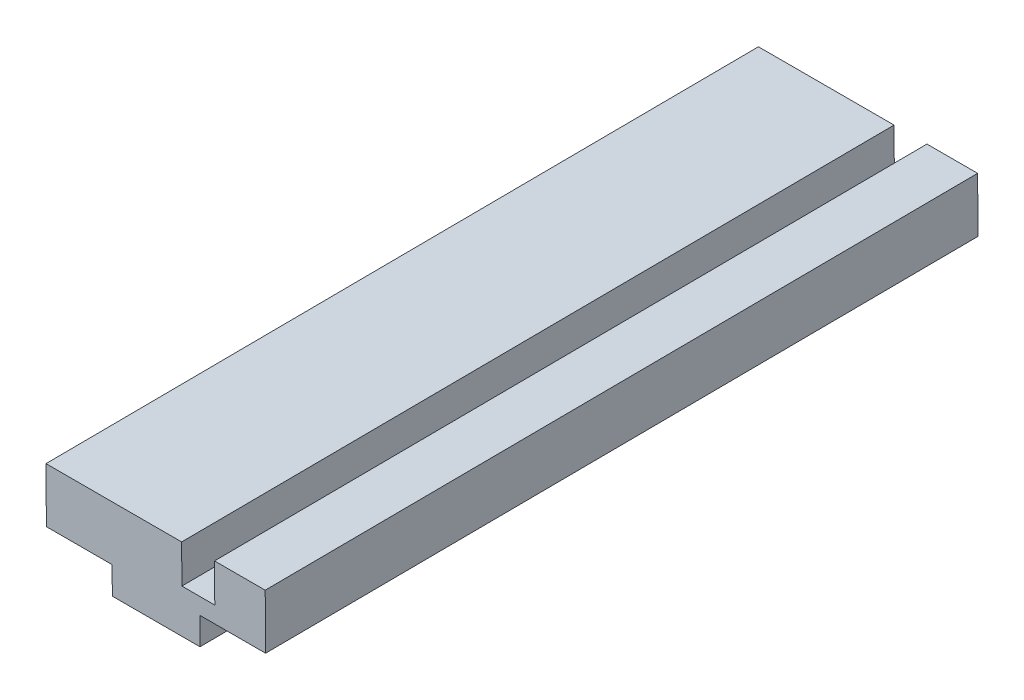
from build123d import *

# Parameters (mm, degrees)
EXTRUDE_1_DEPTH = 130


with BuildPart() as part:
    # 草图1 → 凸台-拉伸1 (new body)
    with BuildSketch(Plane(origin=(0, 0.070410314, -10.430830946), x_dir=(1, 0, 0), z_dir=(0, -0.006750057654754126, 0.9999772181013213))):
        Polygon((-8.5, 9.735119508), (-0.5, 9.735119508), (-0.5, 24.735119508), (-20.5, 24.735119508), (-20.5, 14.735119508), (-8.5, 14.735119508), align=None)
        Polygon((-0.5, 24.735119508), (-0.5, 9.735119508), (7.5, 9.735119508), (7.5, 14.735119508), (19.5, 14.735119508), (19.5, 24.735119508), (10.2499492, 24.735119508), (10.2499492, 22.735119508), (10.2499492, 17.735119508), (4.2499492, 17.735119508), (4.2499492, 22.735119508), (4.2499492, 24.735119508), align=None)
    extrude(amount=-EXTRUDE_1_DEPTH)


solid = part.part
